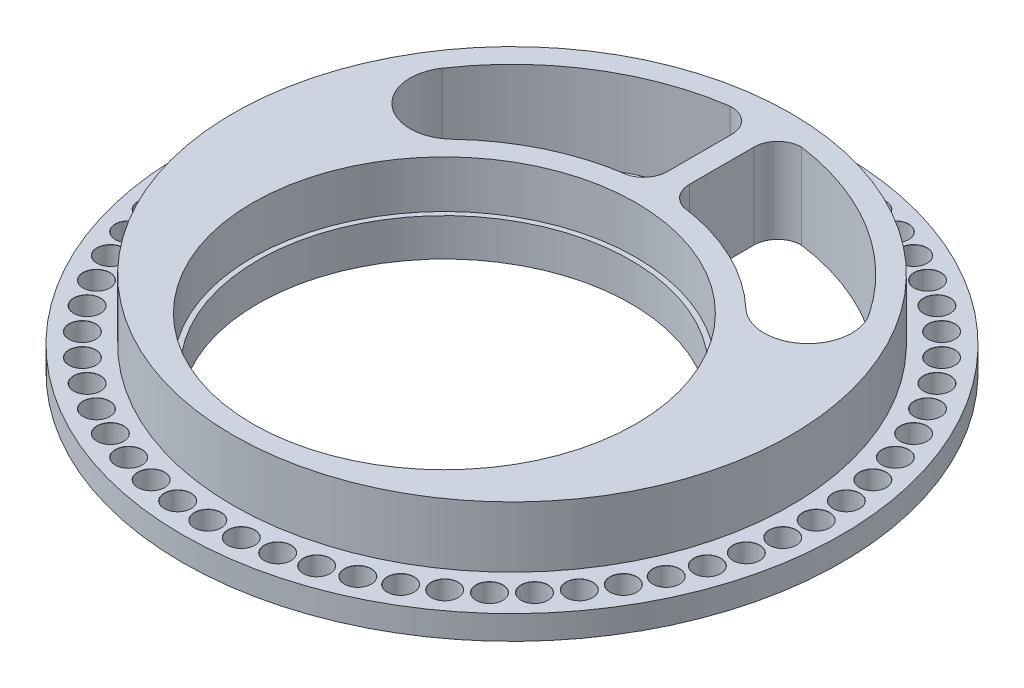
from build123d import *

# Parameters (mm, degrees)
SKETCH1_R                       = 61.9125
SKETCH1_R_2                     = 35.052
BOSS_EXTRUDE1_DEPTH             = 4.5212
SKETCH3_R                       = 52.3875
BOSS_EXTRUDE2_DEPTH             = 11.43
SKETCH4_R                       = 35.052
CUT_EXTRUDE1_DEPTH              = 89.998629731
SKETCH9_R                       = 36.000000009
CUT_EXTRUDE3_DEPTH              = 8.89
F_5_0MM_DOWEL_HOLE1_D           = 5
F_5_0MM_DOWEL_HOLE1_CSINK_D     = 5.05
F_5_0MM_DOWEL_HOLE1_CSINK_ANGLE = 90
CIRPATTERN1_COUNT               = 60
CUT_EXTRUDE5_DEPTH              = 89.998629731
BOSS_EXTRUDE3_REACH             = 89.92
BOSS_EXTRUDE3_DIRECTION_2_REACH = 89.92


with BuildPart() as part:
    # Sketch1 → Boss-Extrude1 (new body)
    with BuildSketch(Plane(origin=(0, 0, 0), x_dir=(1, 0, 0), z_dir=(0, 1, 0))):
        with Locations(Location((0, 0, 0), (0, 0, 270))):
            Circle(SKETCH1_R)
        with Locations(Location((0, -12.7, 0), (0, 0, 270))):
            Circle(SKETCH1_R_2, mode=Mode.SUBTRACT)
    extrude(amount=BOSS_EXTRUDE1_DEPTH)

    # Sketch3 → Boss-Extrude2 (add)
    with BuildSketch(Plane(origin=(0, 4.5212, 0), x_dir=(1, 0, 0), z_dir=(0, 1, 0))):
        with Locations(Location((0, 0, 0), (0, 0, 270))):
            Circle(SKETCH3_R)
    extrude(amount=BOSS_EXTRUDE2_DEPTH)

    # Sketch4 → Cut-Extrude1 (cut, through all)
    with BuildSketch(Plane.XZ):
        with Locations(Location((0, 12.7, 0), (0, 0, 270))):
            Circle(SKETCH4_R)
    extrude(amount=-CUT_EXTRUDE1_DEPTH, mode=Mode.SUBTRACT)

    # Sketch9 → Cut-Extrude3 (cut)
    with BuildSketch(Plane(origin=(0, 15.9512, 0), x_dir=(1, 0, 0), z_dir=(0, 1, 0))):
        with Locations(Location((0, -12.7, 0), (0, 0, 270))):
            Circle(SKETCH9_R)
    extrude(amount=-CUT_EXTRUDE3_DEPTH, mode=Mode.SUBTRACT)

    # Ø5.0mm Dowel Hole1 (through all)
    with Locations(Plane(origin=(0, 4.5212, 0), x_dir=(1, 0, 0), z_dir=(0, 1, 0))):
        with Locations((0, 57.15)):
            f_5_0mm_dowel_hole1 = CounterSinkHole(F_5_0MM_DOWEL_HOLE1_D / 2, F_5_0MM_DOWEL_HOLE1_CSINK_D / 2, counter_sink_angle=F_5_0MM_DOWEL_HOLE1_CSINK_ANGLE)

    # CirPattern1: Ø5.0mm Dowel Hole1 ×60 about axis
    cirpattern1_axis = Axis((0, 0, 0), (0, 1, 0))
    for i in range(1, CIRPATTERN1_COUNT):
        add(f_5_0mm_dowel_hole1.rotate(cirpattern1_axis, i * 360 / CIRPATTERN1_COUNT), mode=Mode.SUBTRACT)

    # Sketch10 → Cut-Extrude5 (cut, through all)
    with BuildSketch(Plane(origin=(0, 15.9512, 0), x_dir=(1, 0, 0), z_dir=(0, 1, 0))):
        with BuildLine():
            ThreePointArc((-27.568698422, 16.370448294), (0, 27.364000009), (27.568698422, 16.370448294))
            ThreePointArc((27.568698422, 16.370448294), (38.57955057, 16.056999754), (40.099152196, 26.966991775))
            ThreePointArc((40.099152196, 26.966991775), (0, 48.3235), (-40.099152196, 26.966991775))
            ThreePointArc((-40.099152196, 26.966991775), (-38.57955057, 16.056999754), (-27.568698422, 16.370448294))
        make_face()
    extrude(amount=-CUT_EXTRUDE5_DEPTH, mode=Mode.SUBTRACT)

    # Boss-Extrude3: up to this face of the body (flat: up to its plane)
    boss_extrude3_end = Plane(part.part.faces().sort_by_distance((0, 15.9512, -50.90575774))[0])
    # Sketch15 → Boss-Extrude3 (add, up to the picked face)
    with BuildSketch(Plane(origin=(0, 7.9756, 0), x_dir=(1, 0, 0), z_dir=(0, 1, 0)), mode=Mode.PRIVATE) as boss_extrude3_sk1:
        with BuildLine():
            ThreePointArc((2.032, 31.29096677), (2.926793499, 28.616259533), (5.250924096, 27.018407481))
            ThreePointArc((5.250924096, 27.018407481), (-0.056014781, 27.363960851), (-5.361966653, 27.003569239))
            ThreePointArc((-5.361966653, 27.003569239), (-3.020045747, 28.598028587), (-2.11713302, 31.283478782))
            Line((-2.11713302, 31.283478782), (-2.11713302, 43.39578959))
            ThreePointArc((-2.11713302, 43.39578959), (-3.543125847, 46.658245825), (-6.906163701, 47.827456081))
            ThreePointArc((-6.906163701, 47.827456081), (-0.203176512, 48.32307287), (6.503741299, 47.883838624))
            ThreePointArc((6.503741299, 47.883838624), (3.343379097, 46.591449005), (2.032, 43.438919063))
            Line((2.032, 43.438919063), (2.032, 31.29096677))
        make_face()
    boss_extrude3_tool1 = split(extrude(boss_extrude3_sk1.sketch, amount=BOSS_EXTRUDE3_REACH, mode=Mode.PRIVATE), bisect_by=boss_extrude3_end, keep=Keep.BOTH, mode=Mode.PRIVATE)
    add(boss_extrude3_tool1.solids().sort_by(Axis((-0.049426, 7.9756, -38.213586), (0, 1, 0)))[0])

    # Boss-Extrude3 direction 2: up to this face of the body (flat: up to its plane)
    boss_extrude3_direction_2_end = Plane(part.part.faces().sort_by_distance((0, 0, -60.161350056))[0])
    # Sketch15 → Boss-Extrude3 direction 2 (add, up to the picked face)
    with BuildSketch(Plane(origin=(0, 7.9756, 0), x_dir=(1, 0, 0), z_dir=(0, 1, 0)), mode=Mode.PRIVATE) as boss_extrude3_direction_2_sk1:
        with BuildLine():
            ThreePointArc((2.032, 31.29096677), (2.926793499, 28.616259533), (5.250924096, 27.018407481))
            ThreePointArc((5.250924096, 27.018407481), (-0.056014781, 27.363960851), (-5.361966653, 27.003569239))
            ThreePointArc((-5.361966653, 27.003569239), (-3.020045747, 28.598028587), (-2.11713302, 31.283478782))
            Line((-2.11713302, 31.283478782), (-2.11713302, 43.39578959))
            ThreePointArc((-2.11713302, 43.39578959), (-3.543125847, 46.658245825), (-6.906163701, 47.827456081))
            ThreePointArc((-6.906163701, 47.827456081), (-0.203176512, 48.32307287), (6.503741299, 47.883838624))
            ThreePointArc((6.503741299, 47.883838624), (3.343379097, 46.591449005), (2.032, 43.438919063))
            Line((2.032, 43.438919063), (2.032, 31.29096677))
        make_face()
    boss_extrude3_direction_2_tool1 = split(extrude(boss_extrude3_direction_2_sk1.sketch, amount=-BOSS_EXTRUDE3_DIRECTION_2_REACH, mode=Mode.PRIVATE), bisect_by=boss_extrude3_direction_2_end, keep=Keep.BOTH, mode=Mode.PRIVATE)
    add(boss_extrude3_direction_2_tool1.solids().sort_by(Axis((-0.049426, 7.9756, -38.213586), (0, -1, 0)))[0])


solid = part.part
